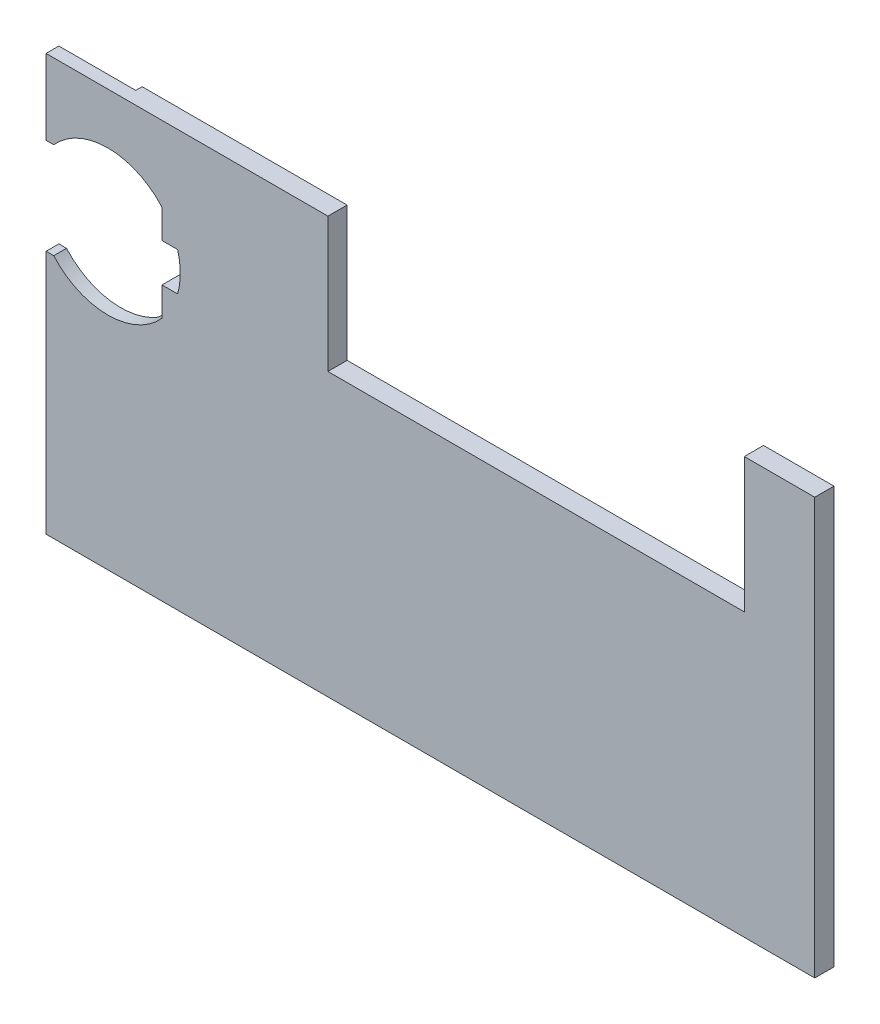
from build123d import *

# Parameters (mm, degrees)
P_IDAT_VYSUNUT_M1_DEPTH  = 3
SKICA3_W                 = 20.45
SKICA3_H                 = 3
ODEBRAT_VYSUNUT_M1_DEPTH = 1
ODEBRAT_VYSUNUT_M2_DEPTH = 1
ODEBRAT_VYSUNUT_M3_DEPTH = 1
SKICA6_W                 = 65
SKICA6_H                 = 21
ODEBRAT_VYSUNUT_M4_DEPTH = 69.302635381


with BuildPart() as part:
    # Skica2 → Přidat vysunutím1 (new body)
    with BuildSketch(Plane.XY):
        with BuildLine():
            Line((-60, 20.75), (-58.8, 20.75))
            ThreePointArc((-58.8, 20.75), (-50.347781356, 24.55), (-41.895562713, 20.75))
            Line((-41.895562713, 20.75), (-41.895562713, 16.25))
            Line((-41.895562713, 16.25), (-39.453287334, 16.25))
            ThreePointArc((-39.453287334, 16.25), (-39.047781356, 13.25), (-39.453287334, 10.25))
            Line((-39.453287334, 10.25), (-41.895562713, 10.25))
            Line((-41.895562713, 10.25), (-41.895562713, 5.75))
            ThreePointArc((-41.895562713, 5.75), (-50.347781356, 1.95), (-58.8, 5.75))
            Line((-58.8, 5.75), (-60, 5.75))
            Line((-60, 5.75), (-60, -32.5))
            Line((-60, -32.5), (60, -32.5))
            Line((60, -32.5), (60, 32.5))
            Line((60, 32.5), (-60, 32.5))
            Line((-60, 32.5), (-60, 20.75))
        make_face()
    extrude(amount=P_IDAT_VYSUNUT_M1_DEPTH)

    # Skica3 → Odebrat vysunutím1 (cut)
    with BuildSketch(Plane(origin=(0, 0, 0), x_dir=(-1, 0, 0), z_dir=(0, 0, -1))):
        with Locations((33.225, 30)):
            Rectangle(SKICA3_W, SKICA3_H)
    extrude(amount=-ODEBRAT_VYSUNUT_M1_DEPTH, mode=Mode.SUBTRACT)

    # Skica4 → Odebrat vysunutím2 (cut)
    with BuildSketch(Plane(origin=(0, 0, 0), x_dir=(-1, 0, 0), z_dir=(0, 0, -1))):
        Polygon((-59, 31.5), (-56, 31.5), (-56, -28.5), (43.45, -28.5), (43.45, -31.5), (-59, -31.5), align=None)
    extrude(amount=-ODEBRAT_VYSUNUT_M2_DEPTH, mode=Mode.SUBTRACT)

    # Skica5 → Odebrat vysunutím3 (cut)
    with BuildSketch(Plane(origin=(0, 0, 0), x_dir=(-1, 0, 0), z_dir=(0, 0, -1))):
        Polygon((60, 32.5), (48, 32.5), (48, 27.5), (44.45, 27.5), (44.45, -27.5), (48, -27.5), (48, -32.5), (60, -32.5), align=None)
    extrude(amount=-ODEBRAT_VYSUNUT_M3_DEPTH, mode=Mode.SUBTRACT)

    # Skica6 → Odebrat vysunutím4 (cut, through all)
    with BuildSketch(Plane(origin=(0, 0, 0), x_dir=(-1, 0, 0), z_dir=(0, 0, -1))):
        with Locations((-16.5, 22)):
            Rectangle(SKICA6_W, SKICA6_H)
    extrude(amount=-ODEBRAT_VYSUNUT_M4_DEPTH, mode=Mode.SUBTRACT)


solid = part.part
